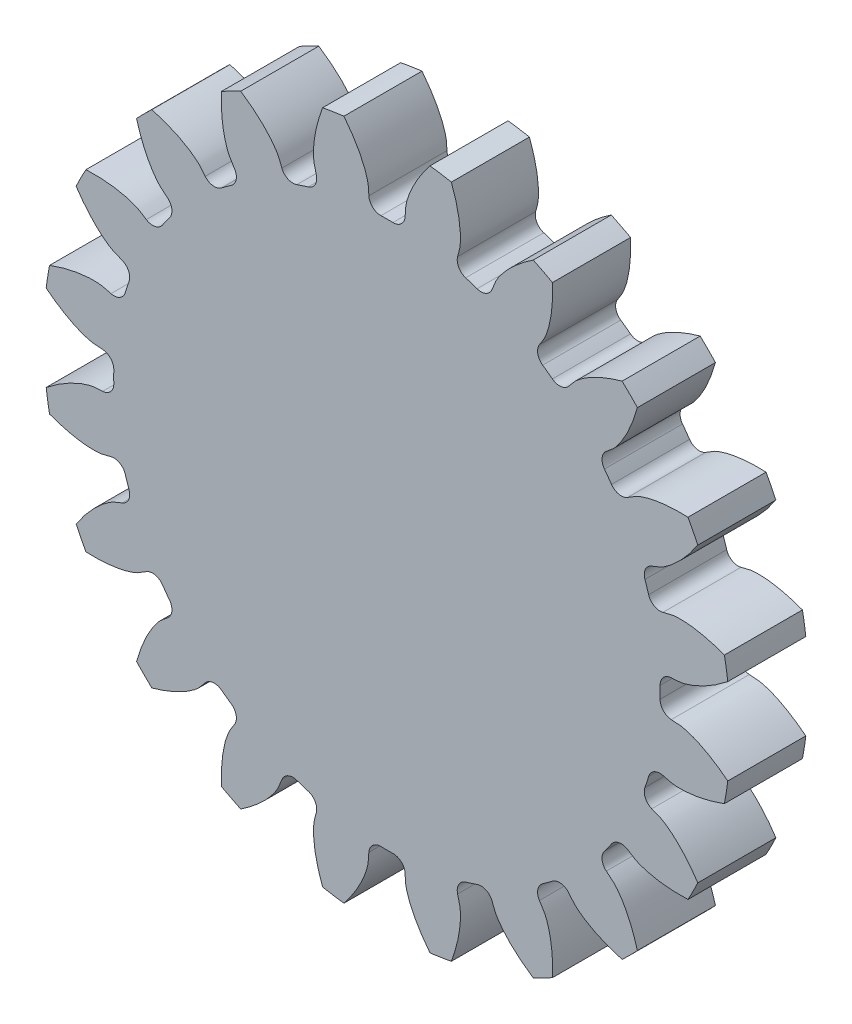
from build123d import *

# Parameters (mm, degrees)
SKETCH_1_R          = 22
LASHENA_DEPTH       = 5
CUT_EXTRUDEA_DEPTH  = 30
WWW_KYTOOL_CN_COUNT = 20


with BuildPart() as part:
    # 草图1 → LaShenA (new body)
    with BuildSketch(Plane.XY):
        Circle(SKETCH_1_R)
    extrude(amount=LASHENA_DEPTH)

    # SketchA → Cut-ExtrudeA (cut)
    with BuildSketch(Plane.XY.offset(5)):
        with BuildLine():
            ThreePointArc((0.385333897, 17.495757137), (0, 17.5), (-0.385333897, 17.495757137))
            ThreePointArc((-0.385333897, 17.495757137), (-0.916561283, 17.696200843), (-1.1606309, 18.208851052))
            add(Edge.make_bspline(
                [(-1.1606309, 18.208851052), (-1.171930077, 18.392301345), (-1.176241251, 18.632580428), (-1.216058012, 18.896848962), (-1.240743696, 19.008516991), (-1.262518892, 19.096928039), (-1.290499427, 19.198195385), (-1.325289132, 19.312068627), (-1.3676305, 19.438230848), (-1.418205326, 19.576348168), (-1.477697907, 19.726054242), (-1.546773605, 19.886955785), (-1.626084178, 20.058631495), (-1.716264818, 20.240633083), (-1.81793375, 20.432485693), (-1.931691083, 20.633688556), (-2.058117912, 20.843715613), (-2.197775372, 21.062016196), (-2.351203737, 21.28801573), (-2.518921525, 21.521116464), (-2.701424703, 21.760698239), (-2.899185586, 22.006119297), (-3.189864756, 22.34735877), (-3.423201244, 22.599173394), (-3.58629474, 22.766196042)],
                knots=[0.125068197, 0.125068197, 0.125068197, 0.125068197, 0.215847125, 0.244833276, 0.257593391, 0.272673526, 0.290073681, 0.309793857, 0.331834054, 0.356194271, 0.382874509, 0.411874767, 0.443195046, 0.476835345, 0.512795666, 0.551076006, 0.591676368, 0.634596749, 0.679837152, 0.727397575, 0.777278019, 0.829478483, 0.883998968, 1, 1, 1, 1], degree=3))
            ThreePointArc((-3.58629474, 22.766196042), (0, 23.046934551), (3.58629474, 22.766196042))
            add(Edge.make_bspline(
                [(1.1606309, 18.208851052), (1.171930077, 18.392301345), (1.176241251, 18.632580428), (1.216058012, 18.896848962), (1.240743696, 19.008516991), (1.262518892, 19.096928039), (1.290499427, 19.198195385), (1.325289132, 19.312068627), (1.3676305, 19.438230848), (1.418205326, 19.576348168), (1.477697907, 19.726054242), (1.546773605, 19.886955785), (1.626084178, 20.058631495), (1.716264818, 20.240633083), (1.81793375, 20.432485693), (1.931691083, 20.633688556), (2.058117912, 20.843715613), (2.197775372, 21.062016196), (2.351203737, 21.28801573), (2.518921525, 21.521116464), (2.701424703, 21.760698239), (2.899185586, 22.006119297), (3.189864756, 22.34735877), (3.423201244, 22.599173394), (3.58629474, 22.766196042)],
                knots=[0.125068197, 0.125068197, 0.125068197, 0.125068197, 0.215847125, 0.244833276, 0.257593391, 0.272673526, 0.290073681, 0.309793857, 0.331834054, 0.356194271, 0.382874509, 0.411874767, 0.443195046, 0.476835345, 0.512795666, 0.551076006, 0.591676368, 0.634596749, 0.679837152, 0.727397575, 0.777278019, 0.829478483, 0.883998968, 1, 1, 1, 1], degree=3))
            ThreePointArc((1.1606309, 18.208851052), (0.916561283, 17.696200843), (0.385333897, 17.495757137))
        make_face()
    cut_extrudea = extrude(amount=-CUT_EXTRUDEA_DEPTH, mode=Mode.SUBTRACT)

    # www.KYTool.cn: Cut-ExtrudeA ×20 about axis
    www_kytool_cn_axis = Axis((0, 0, -88.99), (0, 0, 1))
    for i in range(1, WWW_KYTOOL_CN_COUNT):
        add(cut_extrudea.rotate(www_kytool_cn_axis, i * 360 / WWW_KYTOOL_CN_COUNT), mode=Mode.SUBTRACT)


solid = part.part
